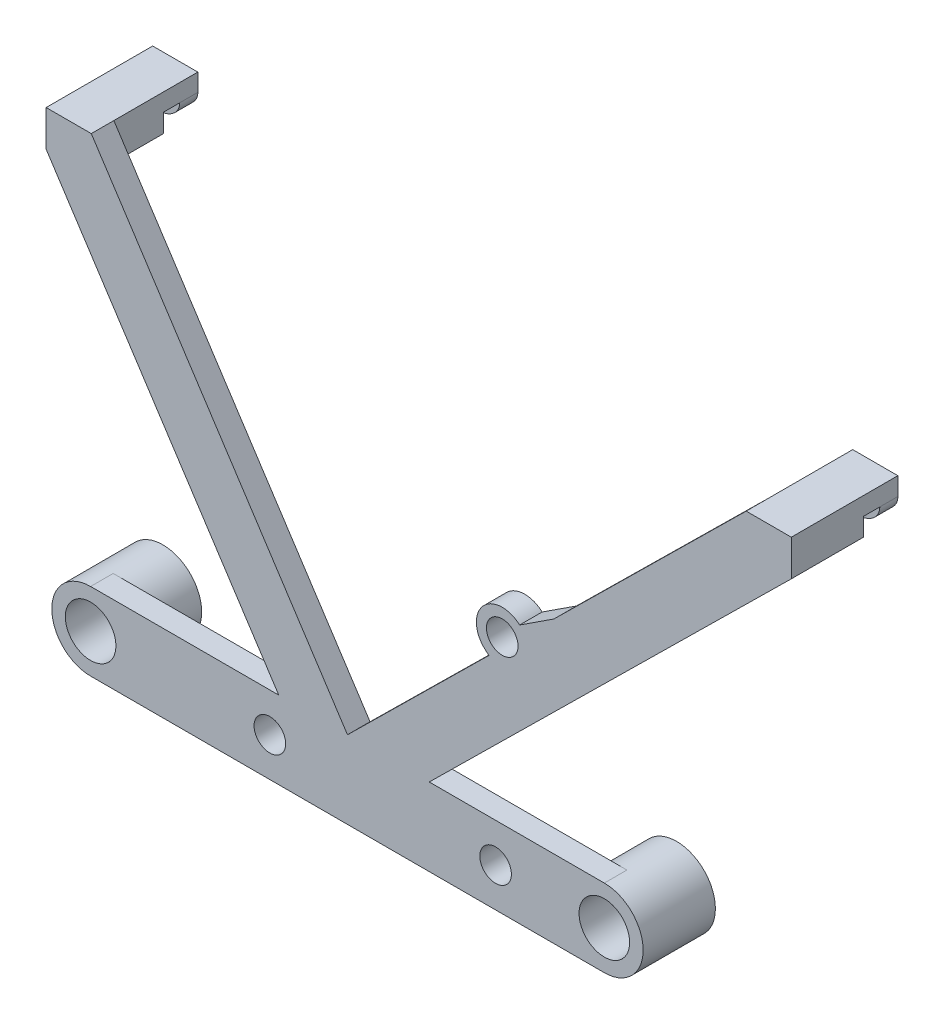
from build123d import *
from build123d.topology import SkipClean

# Parameters (mm, degrees)
SKETCH1_R           = 4.3
SKETCH1_R_2         = 2.8
SKETCH1_W           = 5
SKETCH1_H           = 2
BOSS_EXTRUDE1_DEPTH = 5.5
SKETCH2_R           = 2.8
BOSS_EXTRUDE2_DEPTH = 2.5
SKETCH3_W           = 5
SKETCH3_H           = 2
SKETCH3_H_2         = 1.945877
BOSS_EXTRUDE3_DEPTH = 1.8
SKETCH4_RX          = 2.5
SKETCH4_RY          = 1.945877
BOSS_EXTRUDE4_DEPTH = 2
CUT_EXTRUDE1_REACH  = 116.662
BOSS_EXTRUDE5_DEPTH = 2.5
SKETCH7_R           = 1.75
CUT_EXTRUDE2_DEPTH  = 115.431852156
CUT_EXTRUDE3_DEPTH  = 12.446


with BuildPart() as part:
    # Sketch1 → Boss-Extrude1 (new body)
    # profile 1 of 6: a face of its own
    with BuildSketch(Plane.XY):
        with Locations((-96.304, 4.712)):
            Circle(SKETCH1_R)
        with Locations((-96.304, 4.712)):
            Circle(SKETCH1_R_2, mode=Mode.SUBTRACT)
    # profile 2 of 6: a face of its own
    with BuildSketch(Plane.XY):
        with Locations((-39.408, 4.712)):
            Circle(SKETCH1_R)
        with Locations((-39.408, 4.712)):
            Circle(SKETCH1_R_2, mode=Mode.SUBTRACT)
    # profile 3 of 6: a face of its own
    with BuildSketch(Plane.XY):
        with Locations((-98.72988, 49.487957)):
            Rectangle(SKETCH1_W, SKETCH1_H)
    # profile 4 of 6: a face of its own
    with BuildSketch(Plane.XY):
        with Locations((-98.72988, 51.487957)):
            Rectangle(SKETCH1_W, SKETCH1_H)
    # profile 5 of 6: a face of its own
    with BuildSketch(Plane.XY):
        with Locations((-21.198302598, 49.54208)):
            Rectangle(SKETCH1_W, SKETCH1_H)
    # profile 6 of 6: a face of its own
    with BuildSketch(Plane.XY):
        with Locations((-21.198302598, 51.54208)):
            Rectangle(SKETCH1_W, SKETCH1_H)
    extrude(amount=BOSS_EXTRUDE1_DEPTH)

    # Sketch2 → Boss-Extrude2 (add)
    with BuildSketch(Plane.XY.offset(5.5)):
        with BuildLine():
            Line((-96.304, 0.412), (-39.408, 0.412))
            ThreePointArc((-39.408, 0.412), (-35.108, 4.712), (-39.408, 9.012))
            Line((-39.408, 9.012), (-58.798327935, 9.012))
            Line((-58.798327935, 9.012), (-18.698302598, 48.54208))
            Line((-18.698302598, 48.54208), (-18.698302598, 52.54208))
            Line((-18.698302598, 52.54208), (-23.698302598, 52.54208))
            Line((-23.698302598, 52.54208), (-67.856, 9.012))
            Line((-67.856, 9.012), (-96.22988, 52.487957))
            Line((-96.22988, 52.487957), (-101.22988, 52.487957))
            Line((-101.22988, 52.487957), (-101.22988, 48.487957))
            Line((-101.22988, 48.487957), (-75.46653529, 9.012))
            Line((-75.46653529, 9.012), (-96.304, 9.012))
            ThreePointArc((-96.304, 9.012), (-100.604, 4.712), (-96.304, 0.412))
        make_face()
        with Locations((-96.304, 4.712)):
            Circle(SKETCH2_R, mode=Mode.SUBTRACT)
        with Locations((-39.408, 4.712)):
            Circle(SKETCH2_R, mode=Mode.SUBTRACT)
    extrude(amount=BOSS_EXTRUDE2_DEPTH)

    # Sketch3 → Boss-Extrude3 (add)
    with BuildSketch(Plane(origin=(0, 0, 0), x_dir=(-1, 0, 0), z_dir=(0, 0, -1))):
        with Locations((21.198302598, 51.54208)):
            Rectangle(SKETCH3_W, SKETCH3_H)
        with Locations((98.72988, 51.5150185)):
            Rectangle(SKETCH3_W, SKETCH3_H_2)
    extrude(amount=BOSS_EXTRUDE3_DEPTH)

    # Sketch4 → Boss-Extrude4 (add)
    with BuildSketch(Plane(origin=(0, 0, -1.8), x_dir=(-1, 0, 0), z_dir=(0, 0, -1))):
        with BuildLine():
            add(Edge.make_bspline(
                [(101.22988, 50.54208), (101.22988, 52.487957031), (98.72987996, 52.487957)],
                knots=[0, 0, 0, 1.570796343, 1.570796343, 1.570796343], degree=2, weights=[1, 0.707106776, 1]))
            Line((101.22988, 50.54208), (101.22988, 52.487957))
            Line((101.22988, 52.487957), (98.72987996, 52.487957))
        make_face()
        with BuildLine():
            Line((96.22988, 52.487957), (96.22988, 50.54208))
            add(Edge.make_bspline(
                [(98.72987996, 52.487957), (96.22988, 52.487956969), (96.22988, 50.54208)],
                knots=[1.570796343, 1.570796343, 1.570796343, 3.141592654, 3.141592654, 3.141592654], degree=2, weights=[1, 0.707106787, 1]))
            Line((98.72987996, 52.487957), (96.22988, 52.487957))
        make_face()
        with Locations((98.72988, 50.54208)):
            Ellipse(SKETCH4_RX, SKETCH4_RY)
        with BuildLine():
            Line((18.698302598, 52.54208), (18.698302598, 50.54208))
            add(Edge.make_bspline(
                [(21.198302598, 52.54208), (18.698302598, 52.54208), (18.698302598, 50.54208)],
                knots=[1.570796327, 1.570796327, 1.570796327, 3.141592654, 3.141592654, 3.141592654], degree=2, weights=[1, 0.707106781, 1]))
            Line((21.198302598, 52.54208), (18.698302598, 52.54208))
        make_face()
        with BuildLine():
            add(Edge.make_bspline(
                [(23.698302598, 50.54208), (23.698302598, 52.54208), (21.198302598, 52.54208)],
                knots=[0, 0, 0, 1.570796327, 1.570796327, 1.570796327], degree=2, weights=[1, 0.707106781, 1]))
            Line((23.698302598, 50.54208), (23.698302598, 52.54208))
            Line((23.698302598, 52.54208), (21.198302598, 52.54208))
        make_face()
        with BuildLine():
            Line((23.698302598, 50.54208), (18.698302598, 50.54208))
            add(Edge.make_bspline(
                [(18.698302598, 50.54208), (18.698302598, 48.54208), (21.198302598, 48.54208), (23.698302598, 48.54208), (23.698302598, 50.54208)],
                knots=[3.141592654, 3.141592654, 3.141592654, 4.71238898, 4.71238898, 6.283185307, 6.283185307, 6.283185307], degree=2, weights=[1, 0.707106781, 1, 0.707106781, 1]))
        make_face()
        with BuildLine():
            add(Edge.make_bspline(
                [(21.198302598, 52.54208), (18.698302598, 52.54208), (18.698302598, 50.54208)],
                knots=[1.570796327, 1.570796327, 1.570796327, 3.141592654, 3.141592654, 3.141592654], degree=2, weights=[1, 0.707106781, 1]))
            Line((18.698302598, 50.54208), (23.698302598, 50.54208))
            add(Edge.make_bspline(
                [(23.698302598, 50.54208), (23.698302598, 52.54208), (21.198302598, 52.54208)],
                knots=[0, 0, 0, 1.570796327, 1.570796327, 1.570796327], degree=2, weights=[1, 0.707106781, 1]))
        make_face()
        with BuildLine():
            Line((23.698302598, 50.54208), (18.698302598, 50.54208))
            add(Edge.make_bspline(
                [(18.698302598, 50.54208), (18.698302598, 48.54208), (21.198302598, 48.54208), (23.698302598, 48.54208), (23.698302598, 50.54208)],
                knots=[3.141592654, 3.141592654, 3.141592654, 4.71238898, 4.71238898, 6.283185307, 6.283185307, 6.283185307], degree=2, weights=[1, 0.707106781, 1, 0.707106781, 1]))
        make_face()
        with BuildLine():
            add(Edge.make_bspline(
                [(21.198302598, 52.54208), (18.698302598, 52.54208), (18.698302598, 50.54208)],
                knots=[1.570796327, 1.570796327, 1.570796327, 3.141592654, 3.141592654, 3.141592654], degree=2, weights=[1, 0.707106781, 1]))
            Line((18.698302598, 50.54208), (23.698302598, 50.54208))
            add(Edge.make_bspline(
                [(23.698302598, 50.54208), (23.698302598, 52.54208), (21.198302598, 52.54208)],
                knots=[0, 0, 0, 1.570796327, 1.570796327, 1.570796327], degree=2, weights=[1, 0.707106781, 1]))
        make_face()
    extrude(amount=BOSS_EXTRUDE4_DEPTH)

    # Sketch5 → Cut-Extrude1 (cut, up to next)
    with BuildSketch(Plane.XY.offset(8), mode=Mode.PRIVATE) as cut_extrude1_sk1:
        with BuildLine():
            ThreePointArc((-78.201246925, 4.712), (-76.451246925, 2.962), (-74.701246925, 4.712))
            Line((-74.701246925, 4.712), (-78.201246925, 4.712))
        make_face()
    cut_extrude1_tool1 = extrude(cut_extrude1_sk1.sketch, amount=-CUT_EXTRUDE1_REACH, mode=Mode.PRIVATE) & part.part
    # Sketch5 → Cut-Extrude1 (cut, up to next)
    with BuildSketch(Plane.XY.offset(8), mode=Mode.PRIVATE) as cut_extrude1_sk2:
        with BuildLine():
            Line((-78.201246925, 4.712), (-74.701246925, 4.712))
            ThreePointArc((-74.701246925, 4.712), (-76.451246925, 6.462), (-78.201246925, 4.712))
        make_face()
    cut_extrude1_tool2 = extrude(cut_extrude1_sk2.sketch, amount=-CUT_EXTRUDE1_REACH, mode=Mode.PRIVATE) & part.part
    # Sketch5 → Cut-Extrude1 (cut, up to next)
    with BuildSketch(Plane.XY.offset(8), mode=Mode.PRIVATE) as cut_extrude1_sk3:
        with BuildLine():
            ThreePointArc((-78.201246925, 4.712), (-76.451246925, 2.962), (-74.701246925, 4.712))
            Line((-74.701246925, 4.712), (-78.201246925, 4.712))
        make_face()
    cut_extrude1_tool3 = extrude(cut_extrude1_sk3.sketch, amount=-CUT_EXTRUDE1_REACH, mode=Mode.PRIVATE) & part.part
    # Sketch5 → Cut-Extrude1 (cut, up to next)
    with BuildSketch(Plane.XY.offset(8), mode=Mode.PRIVATE) as cut_extrude1_sk4:
        with BuildLine():
            Line((-78.201246925, 4.712), (-74.701246925, 4.712))
            ThreePointArc((-74.701246925, 4.712), (-76.451246925, 6.462), (-78.201246925, 4.712))
        make_face()
    cut_extrude1_tool4 = extrude(cut_extrude1_sk4.sketch, amount=-CUT_EXTRUDE1_REACH, mode=Mode.PRIVATE) & part.part
    add(cut_extrude1_tool1.solids().sort_by_distance((-76.451247, 3.969277, 8))[0], mode=Mode.SUBTRACT)
    add(cut_extrude1_tool2.solids().sort_by_distance((-76.451247, 5.454723, 8))[0], mode=Mode.SUBTRACT)
    add(cut_extrude1_tool3.solids().sort_by_distance((-76.451247, 3.969277, 8))[0], mode=Mode.SUBTRACT)
    add(cut_extrude1_tool4.solids().sort_by_distance((-76.451247, 5.454723, 8))[0], mode=Mode.SUBTRACT)

    # Sketch6 → Boss-Extrude5 (add, through all)
    with BuildSketch(Plane(origin=(0, 0, 5.5), x_dir=(-1, 0, 0), z_dir=(0, 0, -1))):
        with BuildLine():
            Line((52.194141657, 24.451254914), (52.578584331, 24.780782125))
            ThreePointArc((52.578584331, 24.780782125), (52.86162294, 28.845811152), (48.792917769, 29.069887196))
            Line((48.792917769, 29.069887196), (45.000367772, 31.542783031))
            Line((45.000367772, 31.542783031), (49.066381254, 27.534560172))
            ThreePointArc((49.066381254, 27.534560172), (51.011962302, 28.67771538), (52.466845, 26.952778923))
            ThreePointArc((52.466845, 26.952778923), (52.152438331, 25.951993337), (51.322191527, 25.310811938))
            Line((51.322191527, 25.310811938), (52.194141657, 24.451254914))
        make_face()
    extrude(amount=-BOSS_EXTRUDE5_DEPTH)

    # Sketch7 → Cut-Extrude2 (cut, through all)
    with BuildSketch(Plane(origin=(0, 0, 5.5), x_dir=(-1, 0, 0), z_dir=(0, 0, -1))):
        with Locations((51.451246925, 4.712)):
            Circle(SKETCH7_R)
    extrude(amount=-CUT_EXTRUDE2_DEPTH, mode=Mode.SUBTRACT)

    # Sketch6<3> → Cut-Extrude3 (cut)
    with SkipClean():  # the faces are left unmerged after this step: merging them gives an invalid solid
        with BuildSketch(Plane(origin=(0, 0, 5.5), x_dir=(-1, 0, 0), z_dir=(0, 0, -1))):
            with BuildLine():
                ThreePointArc((49.066381254, 27.534560172), (49.488296444, 25.706517135), (51.322191527, 25.310811938))
                Line((51.322191527, 25.310811938), (49.066381254, 27.534560172))
            make_face()
            with BuildLine():
                Line((49.066381254, 27.534560172), (51.322191527, 25.310811938))
                ThreePointArc((51.322191527, 25.310811938), (52.152438331, 25.951993337), (52.466845, 26.952778923))
                ThreePointArc((52.466845, 26.952778923), (51.011962302, 28.67771538), (49.066381254, 27.534560172))
            make_face()
        extrude(amount=-CUT_EXTRUDE3_DEPTH, mode=Mode.SUBTRACT)


solid = part.part
